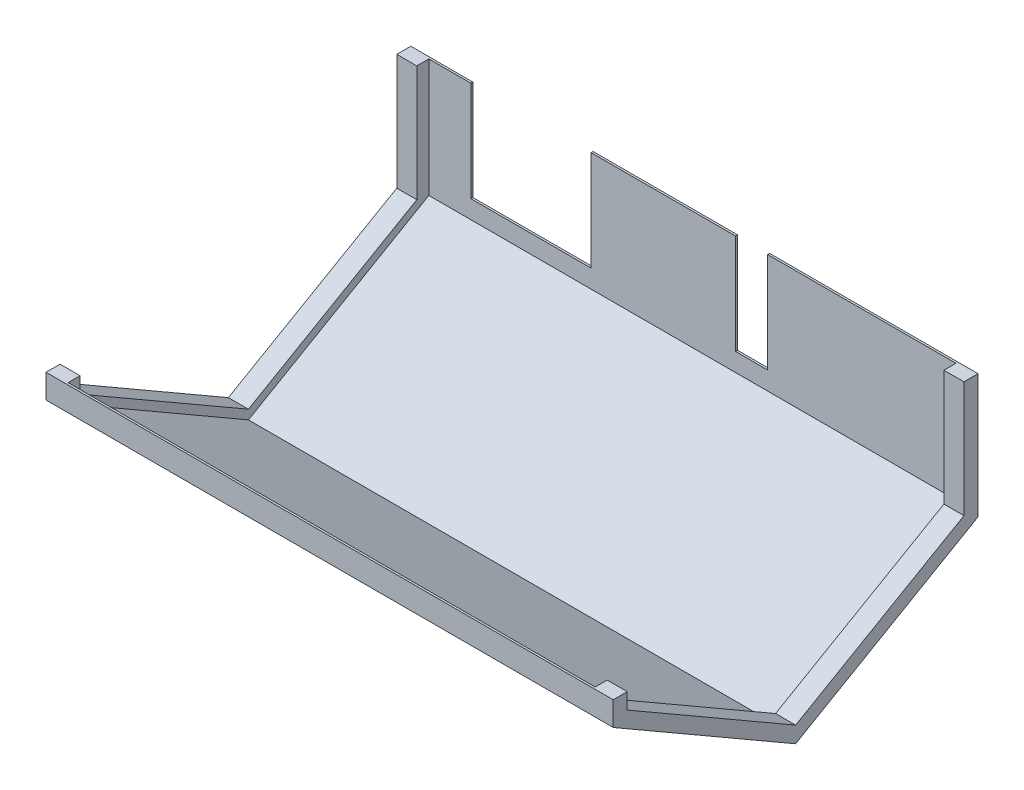
from build123d import *

# Parameters (mm, degrees)
EXTRUDE_1_DEPTH     = 13150
EXTRUDE_2_DEPTH     = 500
EXTRUDE_START       = -13150
EXTRUDE_3_DEPTH     = 500
SKETCH_4_W          = 800
SKETCH_4_H          = 2752.478260032
SKETCH_4_W_2        = 3000
SKETCH_4_H_2        = 2728.418031008
CUT_EXTRUDE_2_DEPTH = 460
SKETCH_7_W          = 15709.854083563
SKETCH_7_H          = 3277.507192375
CUT_EXTRUDE_4_DEPTH = 670


with BuildPart() as part:
    # Эскиз2 → Бобышка-Вытянуть1 (new body)
    with BuildSketch(Plane(origin=(0, 0, 0), x_dir=(0, 0, -1), z_dir=(1, 0, 0))):
        Polygon((4500, -2971.28129211), (9050, -344.337567297), (9050, 2750), (9000, 2750), (9000, -200), (4500, -2798.076211353), (0, -200), (0, 2750), (-50, 2750), (-50, -344.337567297), align=None)
    extrude(amount=-EXTRUDE_1_DEPTH)

    # Эскиз5 → Бобышка-Вытянуть2 (add)
    with BuildSketch(Plane(origin=(0, 0, 0), x_dir=(0, 0, -1), z_dir=(1, 0, 0))):
        Polygon((-50, 2750), (-50, -344.337567297), (4500, -2971.28129211), (9050, -344.337567297), (9050, 2750), (8700, 2750), (8700, -142.264973081), (4500, -2567.136103677), (300, -142.264973081), (300, 2750), align=None)
    extrude(amount=EXTRUDE_2_DEPTH)

    # Эскиз5<2> → Бобышка-Вытянуть3 (add)
    with BuildSketch(Plane(origin=(0, 0, 0), x_dir=(0, 0, -1), z_dir=(1, 0, 0)).offset(EXTRUDE_START)):
        Polygon((-50, 2750), (-50, -344.337567297), (4500, -2971.28129211), (9050, -344.337567297), (9050, 2750), (8700, 2750), (8700, -142.264973081), (4500, -2567.136103677), (300, -142.264973081), (300, 2750), align=None)
    extrude(amount=-EXTRUDE_3_DEPTH)

    # Эскиз4 → Вырез-Вытянуть2 (cut)
    with BuildSketch(Plane(origin=(0, 0, -9050), x_dir=(-1, 0, 0), z_dir=(0, 0, -1))):
        with Locations((5100, 1631.901562719)):
            Rectangle(SKETCH_4_W, SKETCH_4_H)
        with Locations((10600, 1619.871448207)):
            Rectangle(SKETCH_4_W_2, SKETCH_4_H_2)
    extrude(amount=-CUT_EXTRUDE_2_DEPTH, mode=Mode.SUBTRACT)

    # Эскиз7 → Вырез-Вытянуть4 (cut)
    with BuildSketch(Plane.XY.offset(50)):
        with Locations((-6585.237035545, 1894.416028891)):
            Rectangle(SKETCH_7_W, SKETCH_7_H)
    extrude(amount=-CUT_EXTRUDE_4_DEPTH, mode=Mode.SUBTRACT)


solid = part.part
